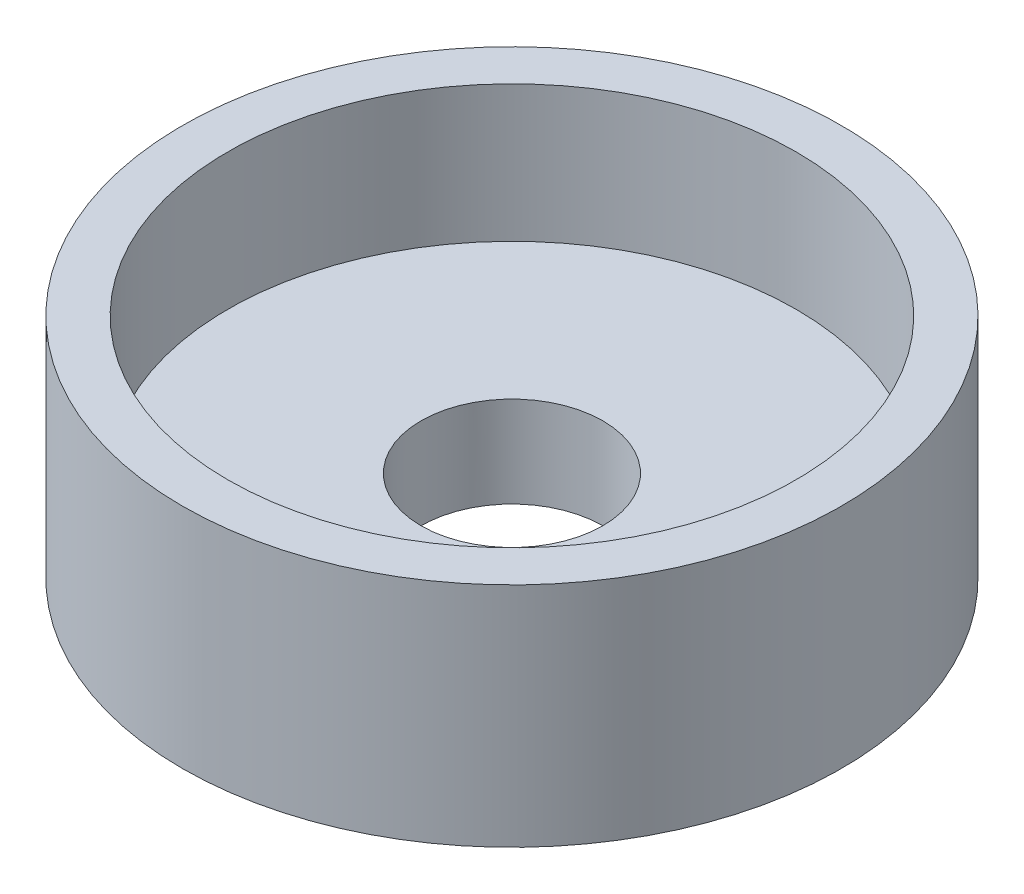
from build123d import *

# Parameters (mm, degrees)
SKETCH1_R           = 14.5
BOSS_EXTRUDE1_DEPTH = 10
SKETCH2_R           = 12.5
CUT_EXTRUDE1_DEPTH  = 6
SKETCH3_R           = 4
CUT_EXTRUDE2_DEPTH  = 23.814469093


with BuildPart() as part:
    # Sketch1 → Boss-Extrude1 (new body)
    with BuildSketch(Plane(origin=(0, 0, 0), x_dir=(1, 0, 0), z_dir=(0, 1, 0))):
        with Locations(Location((0, 0, 0), (0, 0, 270))):
            Circle(SKETCH1_R)
    extrude(amount=BOSS_EXTRUDE1_DEPTH)

    # Sketch2 → Cut-Extrude1 (cut)
    with BuildSketch(Plane(origin=(0, 10, 0), x_dir=(1, 0, 0), z_dir=(0, 1, 0))):
        with Locations(Location((0, 0, 0), (0, 0, 270))):
            Circle(SKETCH2_R)
    extrude(amount=-CUT_EXTRUDE1_DEPTH, mode=Mode.SUBTRACT)

    # Sketch3 → Cut-Extrude2 (cut, through all)
    with BuildSketch(Plane.XZ):
        with Locations(Location((0, 0, 0), (0, 0, 270))):
            Circle(SKETCH3_R)
    extrude(amount=-CUT_EXTRUDE2_DEPTH, mode=Mode.SUBTRACT)


solid = part.part
